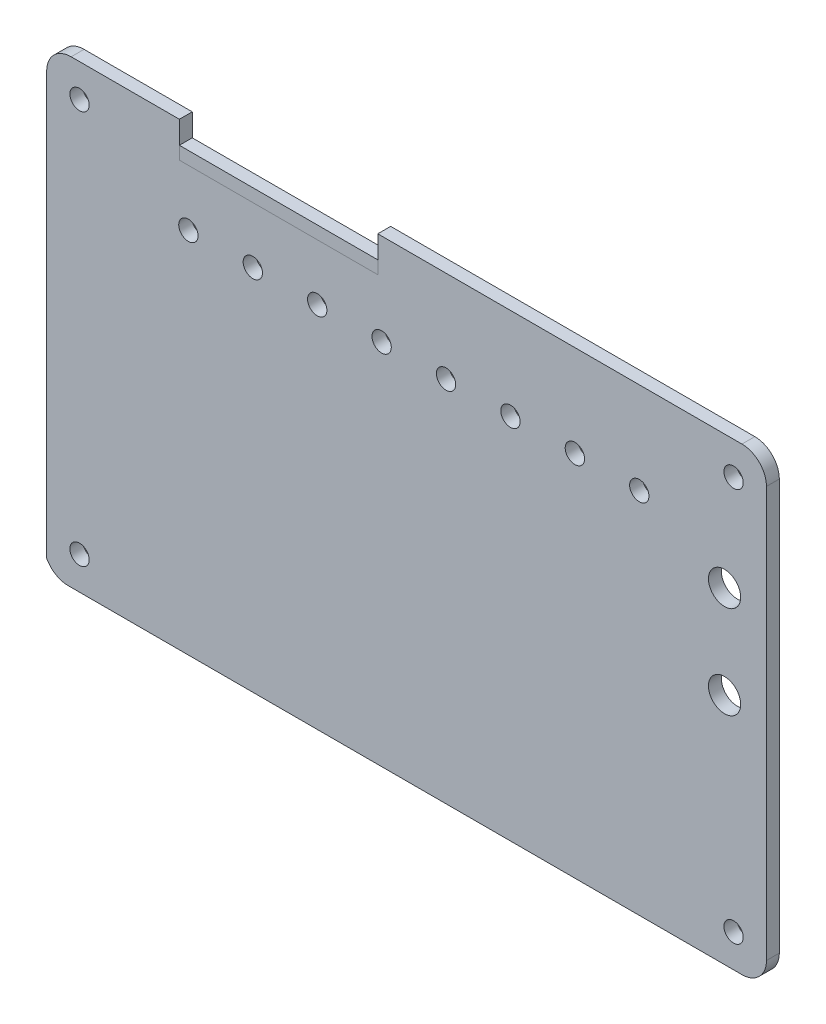
from build123d import *

# Parameters (mm, degrees)
SKIZZE1_R                       = 1.05
AUFSATZ_LINEAR_AUSTRAGEN1_DEPTH = 2
SKIZZE2_R                       = 1.5
SCHNITT_LINEAR_AUSTRAGEN1_DEPTH = 2
SKIZZE3_W                       = 1.4
SKIZZE3_H                       = 5.5
SCHNITT_LINEAR_AUSTRAGEN2_DEPTH = 2
SKIZZE4_W                       = 30.8
SKIZZE4_H                       = 2
AUFSATZ_LINEAR_AUSTRAGEN2_DEPTH = 2
SKIZZE6_R                       = 2.5
SCHNITT_LINEAR_AUSTRAGEN4_DEPTH = 10


with BuildPart() as part:
    # Skizze1 → Aufsatz-Linear austragen1 (new body)
    with BuildSketch(Plane.XY):
        with BuildLine():
            Line((-55.366132402, -34.049552882), (-55.366132402, 31.490447118))
            ThreePointArc((-55.366132402, 31.490447118), (-54.253138171, 34.177452886), (-51.566132402, 35.290447118))
            Line((-51.566132402, 35.290447118), (-33.366132402, 35.290447118))
            Line((-33.366132402, 35.290447118), (-33.366132402, 29.790447118))
            Line((-33.366132402, 29.790447118), (-5.366132402, 29.790447118))
            Line((-5.366132402, 29.790447118), (-5.366132402, 35.290447118))
            Line((-5.366132402, 35.290447118), (52.573867598, 35.290447118))
            ThreePointArc((52.573867598, 35.290447118), (55.260873366, 34.177452886), (56.373867598, 31.490447118))
            Line((56.373867598, 31.490447118), (56.373867598, -32.249552882))
            ThreePointArc((56.373867598, -32.249552882), (55.260873366, -34.936558651), (52.573867598, -36.049552882))
            Line((52.573867598, -36.049552882), (48.523867598, -36.049552882))
            Line((48.523867598, -36.049552882), (-48.019492296, -36.049552882))
            Line((-48.019492296, -36.049552882), (-52.019492296, -36.049552882))
            ThreePointArc((-52.019492296, -36.049552882), (-53.968851165, -35.511454168), (-55.366132402, -34.049552882))
        make_face()
        with Locations((-50.266132402, 30.190447118)):
            Circle(SKIZZE1_R, mode=Mode.SUBTRACT)
        with Locations((-50.266132402, -30.949552882)):
            Circle(SKIZZE1_R, mode=Mode.SUBTRACT)
        with Locations((51.273867598, -30.949552882)):
            Circle(SKIZZE1_R, mode=Mode.SUBTRACT)
        with BuildLine():
            ThreePointArc((50.223911393, 30.200037089), (50.865581728, 29.223078187), (52.013189365, 29.444857871))
            ThreePointArc((52.013189365, 29.444857871), (51.682153467, 31.157816049), (50.223911393, 30.200037089))
        make_face(mode=Mode.SUBTRACT)
    extrude(amount=AUFSATZ_LINEAR_AUSTRAGEN1_DEPTH)

    # Skizze2 → Schnitt-Linear austragen1 (cut)
    with BuildSketch(Plane.XY.offset(2)):
        with Locations((-33.366132402, 21.061999377)):
            Circle(SKIZZE2_R)
        with Locations((-23.366132402, 21.061999377)):
            Circle(SKIZZE2_R)
        with Locations((-13.366132402, 21.061999377)):
            Circle(SKIZZE2_R)
        with Locations((-3.366132402, 21.061999377)):
            Circle(SKIZZE2_R)
        with Locations((6.633867598, 21.061999377)):
            Circle(SKIZZE2_R)
        with Locations((16.633867598, 21.061999377)):
            Circle(SKIZZE2_R)
        with Locations((26.633867598, 21.061999377)):
            Circle(SKIZZE2_R)
        with Locations((36.633867598, 21.061999377)):
            Circle(SKIZZE2_R)
        with Locations((-50.266132402, 30.190447118)):
            Circle(SKIZZE2_R)
        with Locations((51.273867598, 30.190447118)):
            Circle(SKIZZE2_R)
        with Locations((51.273867598, -30.949552882)):
            Circle(SKIZZE2_R)
        with Locations((-50.266132402, -30.949552882)):
            Circle(SKIZZE2_R)
    extrude(amount=-SCHNITT_LINEAR_AUSTRAGEN1_DEPTH, mode=Mode.SUBTRACT)

    # Skizze3 → Schnitt-Linear austragen2 (cut)
    with BuildSketch(Plane.XY.offset(2)):
        with Locations((-4.666132402, 32.540447118)):
            Rectangle(SKIZZE3_W, SKIZZE3_H)
        with Locations((-34.066132402, 32.540447118)):
            Rectangle(SKIZZE3_W, SKIZZE3_H)
    extrude(amount=-SCHNITT_LINEAR_AUSTRAGEN2_DEPTH, mode=Mode.SUBTRACT)

    # Skizze6 → Schnitt-Linear austragen4 (cut)
    with BuildSketch(Plane.XY.offset(2)):
        with Locations((49.873867598, 14.590447118)):
            Circle(SKIZZE6_R)
        with Locations((49.873867598, 0.181573061)):
            Circle(SKIZZE6_R)
    extrude(amount=-SCHNITT_LINEAR_AUSTRAGEN4_DEPTH, mode=Mode.SUBTRACT)


with BuildPart() as body_2:
    # Skizze4 → Aufsatz-Linear austragen2 (new body)
    with BuildSketch(Plane.XY.offset(2)):
        with Locations((-19.366132402, 30.790447118)):
            Rectangle(SKIZZE4_W, SKIZZE4_H)
    extrude(amount=-AUFSATZ_LINEAR_AUSTRAGEN2_DEPTH)


solid = Compound([part.part, body_2.part])
